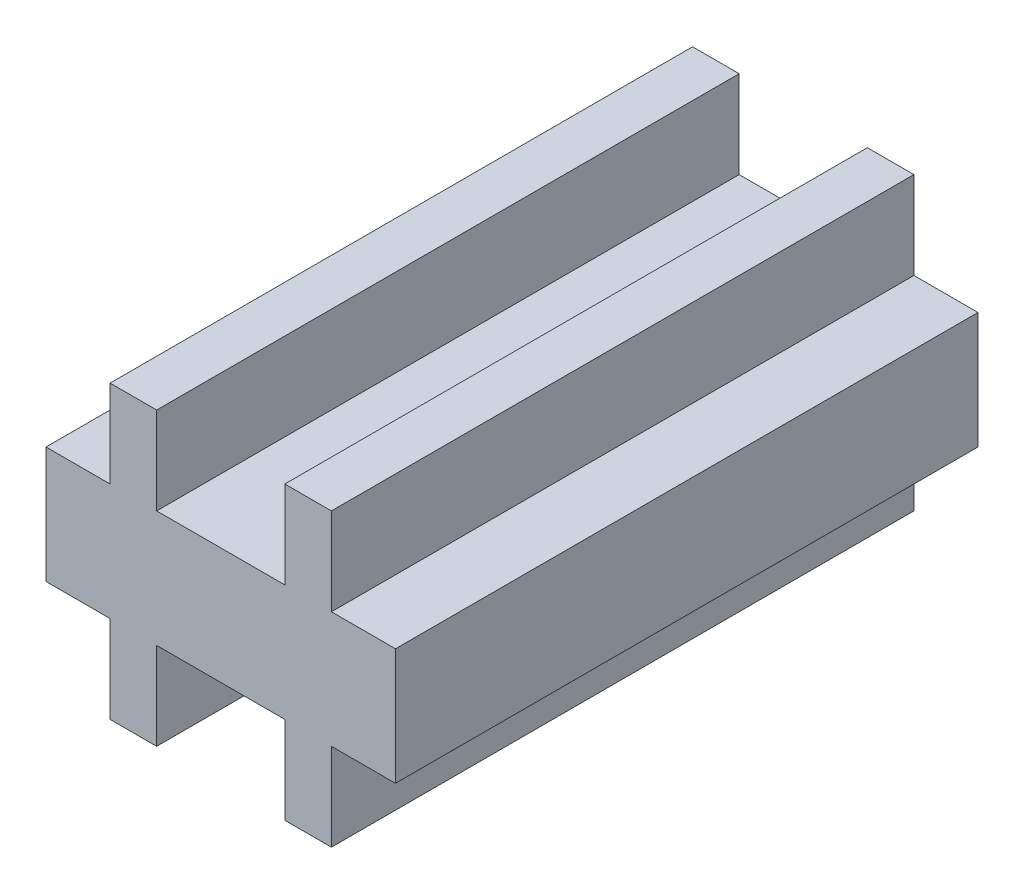
from build123d import *

# Parameters (mm, degrees)
SKETCH_1_W      = 11
SKETCH_1_H      = 20
SKETCH_1_W_2    = 8
SKETCH_1_H_2    = 15
EXTRUDE_1_DEPTH = 100


with BuildPart() as part:
    # Эскиз1 → Бобышка-Вытянуть1 (new body)
    with BuildSketch(Plane.XY):
        with Locations((9.5, 0)):
            Rectangle(SKETCH_1_W, SKETCH_1_H)
        Rectangle(SKETCH_1_W_2, SKETCH_1_H)
        with Locations((-9.5, 0)):
            Rectangle(SKETCH_1_W, SKETCH_1_H)
        with Locations((0, 17.5)):
            Rectangle(SKETCH_1_W_2, SKETCH_1_H_2)
        with Locations((0, -17.5)):
            Rectangle(SKETCH_1_W_2, SKETCH_1_H_2)
    extrude_1 = extrude(amount=EXTRUDE_1_DEPTH)

    # Зеркальное отражение1: Бобышка-Вытянуть1 across plane
    add(extrude_1.mirror(Plane(origin=(-15, 0, 100), x_dir=(0, 0, 1), z_dir=(-1, 0, 0))))


solid = part.part
